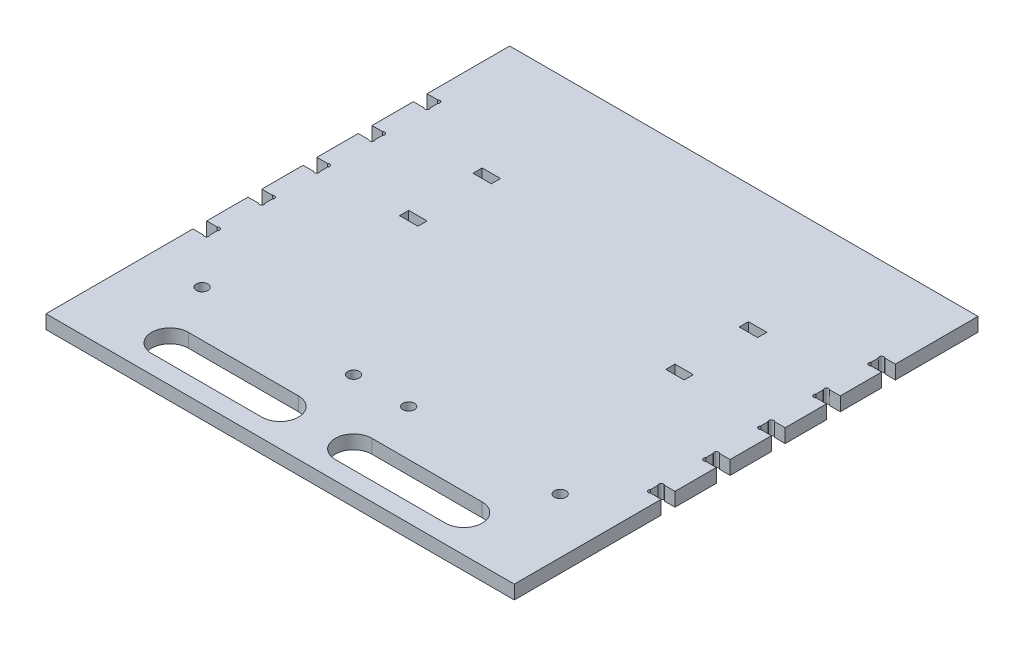
from build123d import *

# Parameters (mm, degrees)
BOSS_EXTRUDE1_DEPTH     = 19.05
SKETCH2_R               = 7.9375
CUT_EXTRUDE1_DEPTH      = 836.260375572
SKETCH3_W               = 25.4
SKETCH3_H               = 12.7
CUT_EXTRUDE2_DEPTH      = 836.260375572
SKETCH4_W               = 444.5
SKETCH4_H               = 114.3
BOSS_EXTRUDE2_DEPTH     = 19.05
CUT_EXTRUDE3_DEPTH      = 836.260375572
CUT_EXTRUDE3_DEPTH_BACK = 836.260375572


with BuildPart() as part:
    # Sketch1 → Boss-Extrude1 (new body)
    with BuildSketch(Plane(origin=(0, 0, 0), x_dir=(1, 0, 0), z_dir=(0, 1, 0))):
        with BuildLine():
            Line((0, 88.9), (0, -114.3))
            Line((0, -114.3), (101.6, -114.3))
            Line((101.6, -114.3), (101.6, 0))
            Line((101.6, 0), (546.1, 0))
            Line((546.1, 0), (546.1, -114.3))
            Line((546.1, -114.3), (647.7, -114.3))
            Line((647.7, -114.3), (647.7, 88.9))
            Line((647.7, 88.9), (633.140128061, 88.9))
            ThreePointArc((633.140128061, 88.9), (628.65, 88.9), (628.65, 93.390128061))
            Line((628.65, 93.390128061), (628.65, 103.459871939))
            ThreePointArc((628.65, 103.459871939), (628.65, 107.95), (633.140128061, 107.95))
            Line((633.140128061, 107.95), (647.7, 107.95))
            Line((647.7, 107.95), (647.7, 165.1))
            Line((647.7, 165.1), (633.140128061, 165.1))
            ThreePointArc((633.140128061, 165.1), (628.65, 165.1), (628.65, 169.590128061))
            Line((628.65, 169.590128061), (628.65, 179.659871939))
            ThreePointArc((628.65, 179.659871939), (628.65, 184.15), (633.140128061, 184.15))
            Line((633.140128061, 184.15), (647.7, 184.15))
            Line((647.7, 184.15), (647.7, 241.3))
            Line((647.7, 241.3), (633.140128061, 241.3))
            ThreePointArc((633.140128061, 241.3), (628.65, 241.3), (628.65, 245.790128061))
            Line((628.65, 245.790128061), (628.65, 255.859871939))
            ThreePointArc((628.65, 255.859871939), (628.65, 260.35), (633.140128061, 260.35))
            Line((633.140128061, 260.35), (647.7, 260.35))
            Line((647.7, 260.35), (647.7, 317.5))
            Line((647.7, 317.5), (633.140128061, 317.5))
            ThreePointArc((633.140128061, 317.5), (628.65, 317.5), (628.65, 321.990128061))
            Line((628.65, 321.990128061), (628.65, 332.059871939))
            ThreePointArc((628.65, 332.059871939), (628.65, 336.55), (633.140128061, 336.55))
            Line((633.140128061, 336.55), (647.7, 336.55))
            Line((647.7, 336.55), (647.7, 393.7))
            Line((647.7, 393.7), (633.140128061, 393.7))
            ThreePointArc((633.140128061, 393.7), (628.65, 393.7), (628.65, 398.190128061))
            Line((628.65, 398.190128061), (628.65, 408.259871939))
            ThreePointArc((628.65, 408.259871939), (628.65, 412.75), (633.140128061, 412.75))
            Line((633.140128061, 412.75), (647.7, 412.75))
            Line((647.7, 412.75), (647.7, 527.05))
            Line((647.7, 527.05), (546.1, 527.05))
            Line((546.1, 527.05), (546.1, 412.75))
            Line((546.1, 412.75), (101.6, 412.75))
            Line((101.6, 412.75), (101.6, 527.05))
            Line((101.6, 527.05), (0, 527.05))
            Line((0, 527.05), (0, 412.75))
            Line((0, 412.75), (14.559871939, 412.75))
            ThreePointArc((14.559871939, 412.75), (19.05, 412.75), (19.05, 408.259871939))
            Line((19.05, 408.259871939), (19.05, 398.190128061))
            ThreePointArc((19.05, 398.190128061), (19.05, 393.7), (14.559871939, 393.7))
            Line((14.559871939, 393.7), (0, 393.7))
            Line((0, 393.7), (0, 336.55))
            Line((0, 336.55), (14.559871939, 336.55))
            ThreePointArc((14.559871939, 336.55), (19.05, 336.55), (19.05, 332.059871939))
            Line((19.05, 332.059871939), (19.05, 321.990128061))
            ThreePointArc((19.05, 321.990128061), (19.05, 317.5), (14.559871939, 317.5))
            Line((14.559871939, 317.5), (0, 317.5))
            Line((0, 317.5), (0, 260.35))
            Line((0, 260.35), (14.559871939, 260.35))
            ThreePointArc((14.559871939, 260.35), (19.05, 260.35), (19.05, 255.859871939))
            Line((19.05, 255.859871939), (19.05, 245.790128061))
            ThreePointArc((19.05, 245.790128061), (19.05, 241.3), (14.559871939, 241.3))
            Line((14.559871939, 241.3), (0, 241.3))
            Line((0, 241.3), (0, 184.15))
            Line((0, 184.15), (14.559871939, 184.15))
            ThreePointArc((14.559871939, 184.15), (19.05, 184.15), (19.05, 179.659871939))
            Line((19.05, 179.659871939), (19.05, 169.590128061))
            ThreePointArc((19.05, 169.590128061), (19.05, 165.1), (14.559871939, 165.1))
            Line((14.559871939, 165.1), (0, 165.1))
            Line((0, 165.1), (0, 107.95))
            Line((0, 107.95), (14.559871939, 107.95))
            ThreePointArc((14.559871939, 107.95), (19.05, 107.95), (19.05, 103.459871939))
            Line((19.05, 103.459871939), (19.05, 93.390128061))
            ThreePointArc((19.05, 93.390128061), (19.05, 88.9), (14.559871939, 88.9))
            Line((14.559871939, 88.9), (0, 88.9))
        make_face()
    extrude(amount=BOSS_EXTRUDE1_DEPTH)

    # Sketch2 → Cut-Extrude1 (cut, through all)
    with BuildSketch(Plane(origin=(0, 19.05, 0), x_dir=(1, 0, 0), z_dir=(0, 1, 0))):
        with Locations(Location((361.95, 25.4, 0), (0, 0, 270))):
            Circle(SKETCH2_R)
        with Locations(Location((285.75, 25.4, 0), (0, 0, 270))):
            Circle(SKETCH2_R)
        with Locations(Location((571.5, 25.4, 0), (0, 0, 270))):
            Circle(SKETCH2_R)
        with Locations(Location((76.2, 25.4, 0), (0, 0, 270))):
            Circle(SKETCH2_R)
    extrude(amount=-CUT_EXTRUDE1_DEPTH, mode=Mode.SUBTRACT)

    # Sketch3 → Cut-Extrude2 (cut, through all)
    with BuildSketch(Plane(origin=(0, 19.05, 0), x_dir=(1, 0, 0), z_dir=(0, 1, 0))):
        with Locations((508, 355.6)):
            Rectangle(SKETCH3_W, SKETCH3_H)
        with Locations((508, 254)):
            Rectangle(SKETCH3_W, SKETCH3_H)
        with Locations((139.7, 254)):
            Rectangle(SKETCH3_W, SKETCH3_H)
        with Locations((139.7, 355.6)):
            Rectangle(SKETCH3_W, SKETCH3_H)
    extrude(amount=-CUT_EXTRUDE2_DEPTH, mode=Mode.SUBTRACT)

    # Sketch4 → Boss-Extrude2 (add)
    with BuildSketch(Plane(origin=(0, 19.05, 0), x_dir=(1, 0, 0), z_dir=(0, 1, 0))):
        with Locations((323.85, -57.15)):
            Rectangle(SKETCH4_W, SKETCH4_H)
        with Locations((323.85, 469.9)):
            Rectangle(SKETCH4_W, SKETCH4_H)
    extrude(amount=-BOSS_EXTRUDE2_DEPTH)

    # Sketch5 → Cut-Extrude3 (cut, two sides: drawn at the far end of the back side and taken through both)
    with BuildSketch(Plane(origin=(0, 19.05, 0), x_dir=(1, 0, 0), z_dir=(0, 1, 0)).offset(-CUT_EXTRUDE3_DEPTH_BACK)):
        with BuildLine():
            Line((374.65, -38.1), (527.05, -38.1))
            ThreePointArc((527.05, -38.1), (552.45, -63.5), (527.05, -88.9))
            Line((527.05, -88.9), (374.65, -88.9))
            ThreePointArc((374.65, -88.9), (349.25, -63.5), (374.65, -38.1))
        make_face()
        with BuildLine():
            Line((273.05, -38.1), (120.65, -38.1))
            ThreePointArc((120.65, -38.1), (95.25, -63.5), (120.65, -88.9))
            Line((120.65, -88.9), (273.05, -88.9))
            ThreePointArc((273.05, -88.9), (298.45, -63.5), (273.05, -38.1))
        make_face()
    extrude(amount=CUT_EXTRUDE3_DEPTH + CUT_EXTRUDE3_DEPTH_BACK, mode=Mode.SUBTRACT)


solid = part.part
